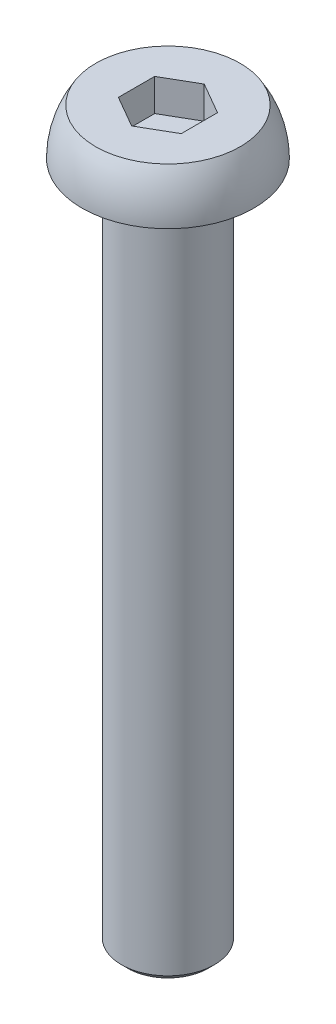
from build123d import *

# Parameters (mm, degrees)
SKETCH_2_R          = 1.5
EXTRUDE_1_DEPTH     = 22
CUT_EXTRUDE_1_DEPTH = 1.04
CHAMFER_1_SIZE      = 0.2


with BuildPart() as part:
    # 草图1 → 旋转1 (revolve)
    with BuildSketch(Plane.XY, mode=Mode.PRIVATE) as revolve_1_sk:
        with BuildLine():
            Line((0, 0), (-2.775, 0))
            ThreePointArc((-2.775, 0), (-2.662639591, 0.78164916), (-2.334657362, 1.5))
            Line((-2.334657362, 1.5), (0, 1.5))
            Line((0, 1.5), (0, 0))
        make_face()
    revolve(revolve_1_sk.sketch.rotate(Axis((0, 5.111773046, 0), (0, -1, 0)), 270), axis=Axis((0, 5.111773046, 0), (0, -1, 0)))

    # 草图2 → 凸台-拉伸1 (add)
    with BuildSketch(Plane.XZ):
        with Locations(Location((0, 0, 0), (0, 0, 270))):
            Circle(SKETCH_2_R)
    extrude(amount=EXTRUDE_1_DEPTH)

    # 草图3 → 切除-拉伸1 (cut)
    with BuildSketch(Plane(origin=(0, 1.5, 0), x_dir=(1, 0, 0), z_dir=(0, 1, 0))):
        Polygon((0, 1.172021046), (-1.015, 0.586010523), (-1.015, -0.586010523), (0, -1.172021046), (1.015, -0.586010523), (1.015, 0.586010523), align=None)
    extrude(amount=-CUT_EXTRUDE_1_DEPTH, mode=Mode.SUBTRACT)

    # 倒角1
    chamfer_1_edges = [part.edges().sort_by_distance(p)[0] for p in [
        (0, -22, 1.5),
    ]]
    chamfer(chamfer_1_edges, length=CHAMFER_1_SIZE)


solid = part.part
